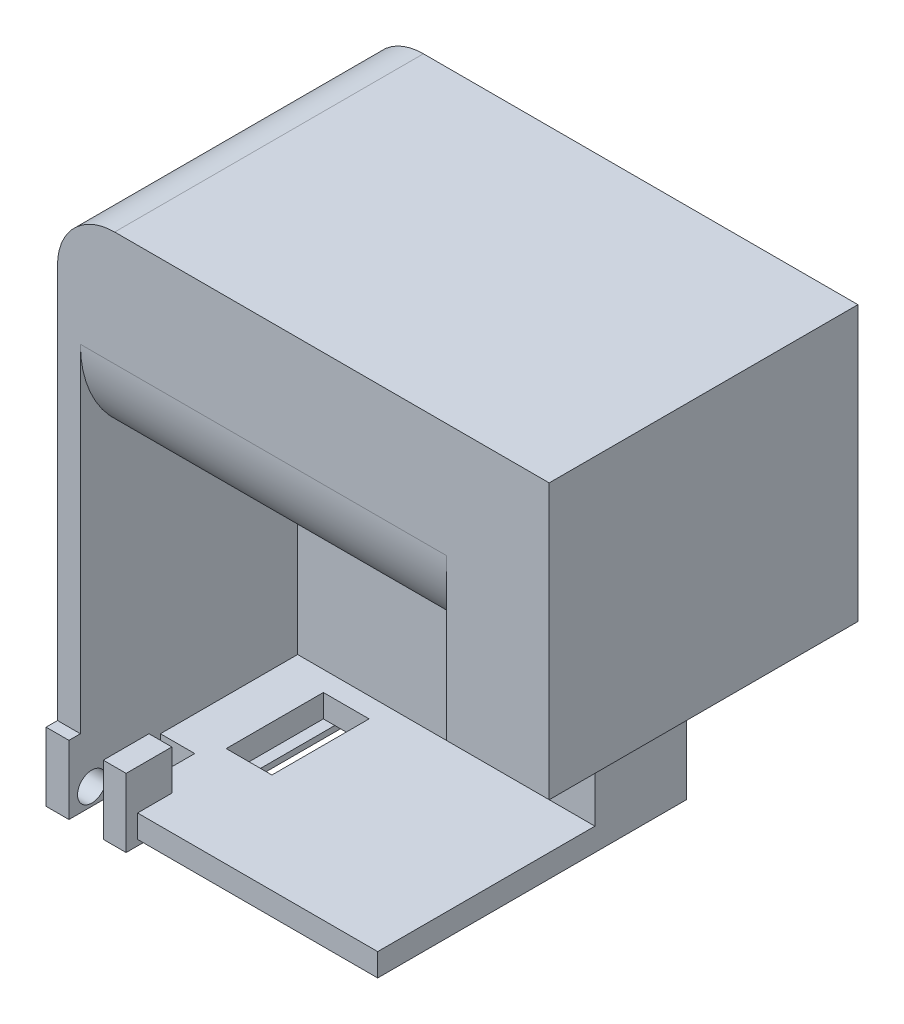
from build123d import *

# Parameters (mm, degrees)
SKETCH1_W            = 28
SKETCH1_H            = 22
BOSS_EXTRUDE1_DEPTH  = 32
SKETCH21_W           = 26
SKETCH21_H           = 23
CUT_EXTRUDE10_DEPTH  = 17
SKETCH22_W           = 4
SKETCH22_H           = 8.5
CUT_EXTRUDE11_DEPTH  = 35.885527085
SKETCH23_W           = 10
SKETCH23_H           = 5
CUT_EXTRUDE12_DEPTH  = 5
SKETCH24_W           = 26
SKETCH24_H           = 24
BOSS_EXTRUDE4_DEPTH  = 15
BOSS_EXTRUDE5_DEPTH  = 28
SKETCH26_W           = 28
SKETCH26_H           = 21
SKETCH26_W_2         = 10
SKETCH26_H_2         = 5
BOSS_EXTRUDE6_DEPTH  = 2
BOSS_EXTRUDE7_DEPTH  = 2
FILLET1_R            = 5
FILLET2_R            = 10
SKETCH31_W           = 2
SKETCH31_H           = 26
BOSS_EXTRUDE8_DEPTH  = 0.5
BOSS_EXTRUDE12_DEPTH = 1
SKETCH41_W           = 2
SKETCH41_H           = 4
BOSS_EXTRUDE15_DEPTH = 3.5
SKETCH44_W           = 7
SKETCH44_H           = 6
BOSS_EXTRUDE17_DEPTH = 1
SKETCH30_R           = 1.25
CUT_EXTRUDE13_DEPTH  = 6
BOSS_EXTRUDE9_DEPTH  = 4
SKETCH37_W           = 1
SKETCH37_H           = 27
BOSS_EXTRUDE13_DEPTH = 0.5
SKETCH38_W           = 3
SKETCH38_H           = 2.5
CUT_EXTRUDE15_DEPTH  = 8
CUT_EXTRUDE16_DEPTH  = 6
SKETCH45_W           = 3
SKETCH45_H           = 6
CUT_EXTRUDE18_DEPTH  = 7
BOSS_EXTRUDE18_START = 1
BOSS_EXTRUDE18_DEPTH = 1
SKETCH48_W           = 10
SKETCH48_H           = 5
CUT_EXTRUDE19_DEPTH  = 60.958318856


with BuildPart() as part:
    # Sketch1 → Boss-Extrude1 (new body)
    with BuildSketch(Plane(origin=(0, 0, 0), x_dir=(1, 0, 0), z_dir=(0, 1, 0))):
        Rectangle(SKETCH1_W, SKETCH1_H)
    extrude(amount=BOSS_EXTRUDE1_DEPTH)

    # Sketch21 → Cut-Extrude10 (cut)
    with BuildSketch(Plane.XY.offset(11)):
        with Locations((1, 13.5)):
            Rectangle(SKETCH21_W, SKETCH21_H)
    extrude(amount=-CUT_EXTRUDE10_DEPTH, mode=Mode.SUBTRACT)

    # Sketch22 → Cut-Extrude11 (cut, through all)
    with BuildSketch(Plane(origin=(0, 2, 0), x_dir=(1, 0, 0), z_dir=(0, 1, 0))):
        with Locations((-6, 0)):
            Rectangle(SKETCH22_W, SKETCH22_H)
    extrude(amount=-CUT_EXTRUDE11_DEPTH, mode=Mode.SUBTRACT)

    # Sketch23 → Cut-Extrude12 (cut)
    with BuildSketch(Plane(origin=(0, 0, -11), x_dir=(-1, 0, 0), z_dir=(0, 0, -1))):
        with Locations((0, 16)):
            Rectangle(SKETCH23_W, SKETCH23_H)
    extrude(amount=-CUT_EXTRUDE12_DEPTH, mode=Mode.SUBTRACT)

    # Sketch24 → Boss-Extrude4 (add)
    with BuildSketch(Plane(origin=(14, 0, 0), x_dir=(0, 0, -1), z_dir=(1, 0, 0))):
        with Locations((0, 33)):
            Rectangle(SKETCH24_W, SKETCH24_H)
    extrude(amount=BOSS_EXTRUDE4_DEPTH)

    # Sketch25 → Boss-Extrude5 (add)
    with BuildSketch(Plane.ZY.offset(-14)):
        Polygon((11, 32), (11, 25), (13, 25), (13, 45), (-13, 45), (-13, 21), (-11, 21), (-11, 32), align=None)
    extrude(amount=BOSS_EXTRUDE5_DEPTH)

    # Sketch26 → Boss-Extrude6 (add)
    with BuildSketch(Plane(origin=(0, 0, -11), x_dir=(-1, 0, 0), z_dir=(0, 0, -1))):
        with Locations((0, 10.5)):
            Rectangle(SKETCH26_W, SKETCH26_H)
        with Locations((0, 16)):
            Rectangle(SKETCH26_W_2, SKETCH26_H_2, mode=Mode.SUBTRACT)
    extrude(amount=BOSS_EXTRUDE6_DEPTH)

    # Sketch27 → Boss-Extrude7 (add)
    with BuildSketch(Plane.XY.offset(11)):
        Polygon((14, 0), (-14, 0), (-14, 2), (-14, 25), (-12, 25), (-12, 2), (14, 2), align=None)
    extrude(amount=BOSS_EXTRUDE7_DEPTH)

    # Fillet1
    fillet1_edges = [part.edges().sort_by_distance(p)[0] for p in [
        (-14, 45, 0),
    ]]
    fillet(fillet1_edges, radius=FILLET1_R)

    # Fillet2
    fillet2_edges = [part.edges().sort_by_distance(p)[0] for p in [
        (1, 25, 13),
    ]]
    fillet(fillet2_edges, radius=FILLET2_R)

    # Sketch31 → Boss-Extrude8 (add)
    with BuildSketch(Plane.XZ):
        with Locations((-13, 0)):
            Rectangle(SKETCH31_W, SKETCH31_H)
    extrude(amount=BOSS_EXTRUDE8_DEPTH)

    # Sketch36 → Boss-Extrude12 (add)
    with BuildSketch(Plane.XY.offset(13)):
        Polygon((-12, 2), (-7, 2), (-7, 0), (-12, 0), (-12, -0.5), (-14, -0.5), (-14, 5.5), (-12, 5.5), align=None)
    extrude(amount=BOSS_EXTRUDE12_DEPTH)

    # Sketch41 → Boss-Extrude15 (add)
    with BuildSketch(Plane(origin=(0, 2, 0), x_dir=(1, 0, 0), z_dir=(0, 1, 0))):
        with Locations((-8, -12)):
            Rectangle(SKETCH41_W, SKETCH41_H)
    extrude(amount=BOSS_EXTRUDE15_DEPTH)

    # Sketch44 → Boss-Extrude17 (add)
    with BuildSketch(Plane(origin=(0, 0, -13), x_dir=(-1, 0, 0), z_dir=(0, 0, -1))):
        with Locations((10.5, 2.5)):
            Rectangle(SKETCH44_W, SKETCH44_H)
    extrude(amount=BOSS_EXTRUDE17_DEPTH)

    # Sketch30 → Cut-Extrude13 (cut)
    with BuildSketch(Plane.ZY.offset(14)):
        with Locations((-12, 1)):
            Circle(SKETCH30_R)
        with Locations((12, 1)):
            Circle(SKETCH30_R)
    extrude(amount=-CUT_EXTRUDE13_DEPTH, mode=Mode.SUBTRACT)

    # Sketch32 → Boss-Extrude9 (add)
    with BuildSketch(Plane(origin=(-12, 0, 0), x_dir=(0, 0, -1), z_dir=(1, 0, 0))):
        with BuildLine():
            Line((13, 0), (12.75, 0))
            ThreePointArc((12.75, 0), (12, -0.25), (11.25, 0))
            Line((11.25, 0), (-11.25, 0))
            ThreePointArc((-11.25, 0), (-12, -0.25), (-12.75, 0))
            Line((-12.75, 0), (-14, 0))
            Line((-14, 0), (-14, -0.5))
            Line((-14, -0.5), (13, -0.5))
            Line((13, -0.5), (13, 0))
        make_face()
    extrude(amount=BOSS_EXTRUDE9_DEPTH)

    # Sketch37 → Boss-Extrude13 (add)
    with BuildSketch(Plane.XZ):
        with Locations((-7.5, 0.5)):
            Rectangle(SKETCH37_W, SKETCH37_H)
    extrude(amount=BOSS_EXTRUDE13_DEPTH)

    # Sketch38 → Cut-Extrude15 (cut)
    with BuildSketch(Plane.XY.offset(14)):
        with Locations((-10.5, 0.75)):
            Rectangle(SKETCH38_W, SKETCH38_H)
    extrude(amount=-CUT_EXTRUDE15_DEPTH, mode=Mode.SUBTRACT)

    # Sketch39 → Cut-Extrude16 (cut)
    with BuildSketch(Plane.ZY.offset(-14)):
        with BuildLine():
            Line((13, 21), (13, 35))
            ThreePointArc((13, 35), (10.071067812, 27.928932188), (3, 25))
            Line((3, 25), (-6, 25))
            Line((-6, 25), (-6, 21))
            Line((-6, 21), (13, 21))
        make_face()
    extrude(amount=-CUT_EXTRUDE16_DEPTH, mode=Mode.SUBTRACT)

    # Sketch45 → Cut-Extrude18 (cut)
    with BuildSketch(Plane(origin=(0, 0, -14), x_dir=(-1, 0, 0), z_dir=(0, 0, -1))):
        with Locations((10.5, 2.5)):
            Rectangle(SKETCH45_W, SKETCH45_H)
    extrude(amount=-CUT_EXTRUDE18_DEPTH, mode=Mode.SUBTRACT)

    # Sketch46 → Boss-Extrude18 (add)
    with BuildSketch(Plane(origin=(0, 0, -13), x_dir=(-1, 0, 0), z_dir=(0, 0, -1)).offset(BOSS_EXTRUDE18_START)):
        with BuildLine():
            Line((7, 0), (7, 5.5))
            Line((7, 5.5), (9, 5.5))
            Line((9, 5.5), (12, 5.5))
            Line((12, 5.5), (14, 5.5))
            Line((14, 5.5), (14, 40))
            ThreePointArc((14, 40), (12.535533906, 43.535533906), (9, 45))
            Line((9, 45), (-29, 45))
            Line((-29, 45), (-29, 21))
            Line((-29, 21), (-14, 21))
            Line((-14, 21), (-14, 0))
            Line((-14, 0), (7, 0))
        make_face()
    extrude(amount=-BOSS_EXTRUDE18_DEPTH)

    # Sketch48 → Cut-Extrude19 (cut, through all)
    with BuildSketch(Plane.XY.offset(-13)):
        with Locations((0, 16)):
            Rectangle(SKETCH48_W, SKETCH48_H)
    extrude(amount=-CUT_EXTRUDE19_DEPTH, mode=Mode.SUBTRACT)


solid = part.part
